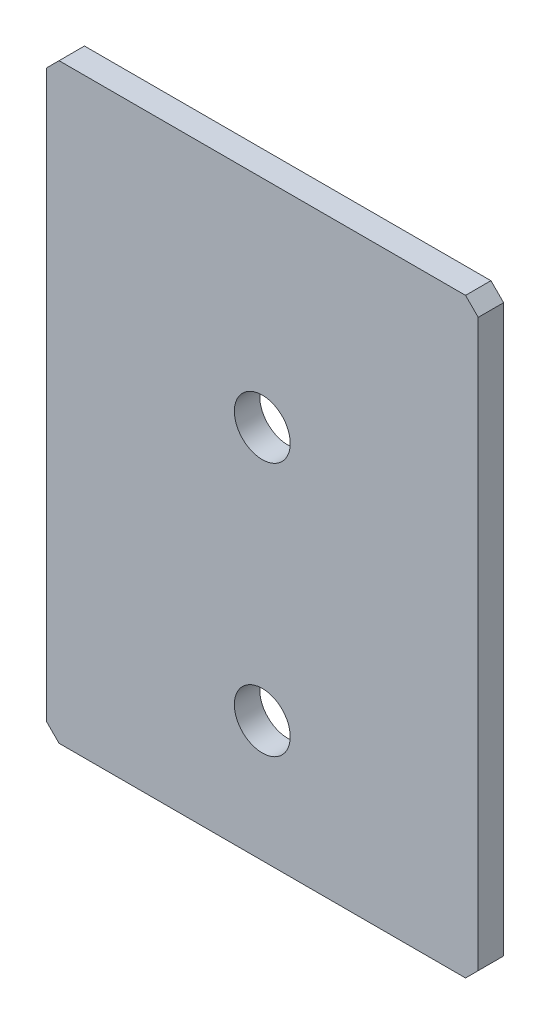
from build123d import *

# Parameters (mm, degrees)
SKETCH1_W           = 170
SKETCH1_H           = 232.717889213
SKETCH1_R           = 11
BOSS_EXTRUDE1_DEPTH = 10
CHAMFER1_SIZE       = 5


with BuildPart() as part:
    # Sketch1 → Boss-Extrude1 (new body)
    with BuildSketch(Plane.XY):
        with Locations((0, -31.358944607)):
            Rectangle(SKETCH1_W, SKETCH1_H)
        Circle(SKETCH1_R, mode=Mode.SUBTRACT)
        with Locations((0, -100)):
            Circle(SKETCH1_R, mode=Mode.SUBTRACT)
    extrude(amount=BOSS_EXTRUDE1_DEPTH)

    # Chamfer1
    chamfer1_edges = [part.edges().sort_by_distance(p)[0] for p in [
        (-85, 85, 5),
        (85, 85, 5),
        (85, -147.717889213, 5),
        (-85, -147.717889213, 5),
    ]]
    chamfer(chamfer1_edges, length=CHAMFER1_SIZE)


solid = part.part
